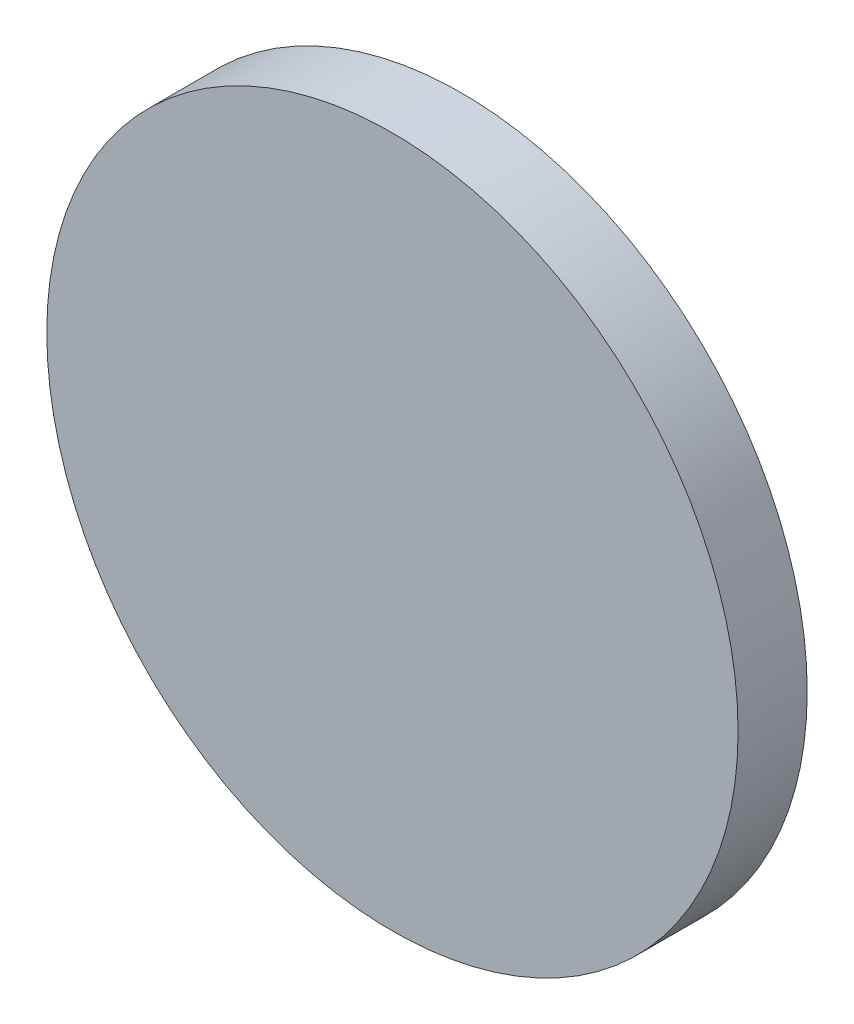
from build123d import *

# Parameters (mm, degrees)
SKETCH1_R          = 50
BASE_EXTRUDE_DEPTH = 10


with BuildPart() as part:
    # Sketch1 → Base-Extrude (new body)
    with BuildSketch(Plane.XY):
        with Locations((0, 179.95)):
            Circle(SKETCH1_R)
    extrude(amount=-BASE_EXTRUDE_DEPTH)


solid = part.part
